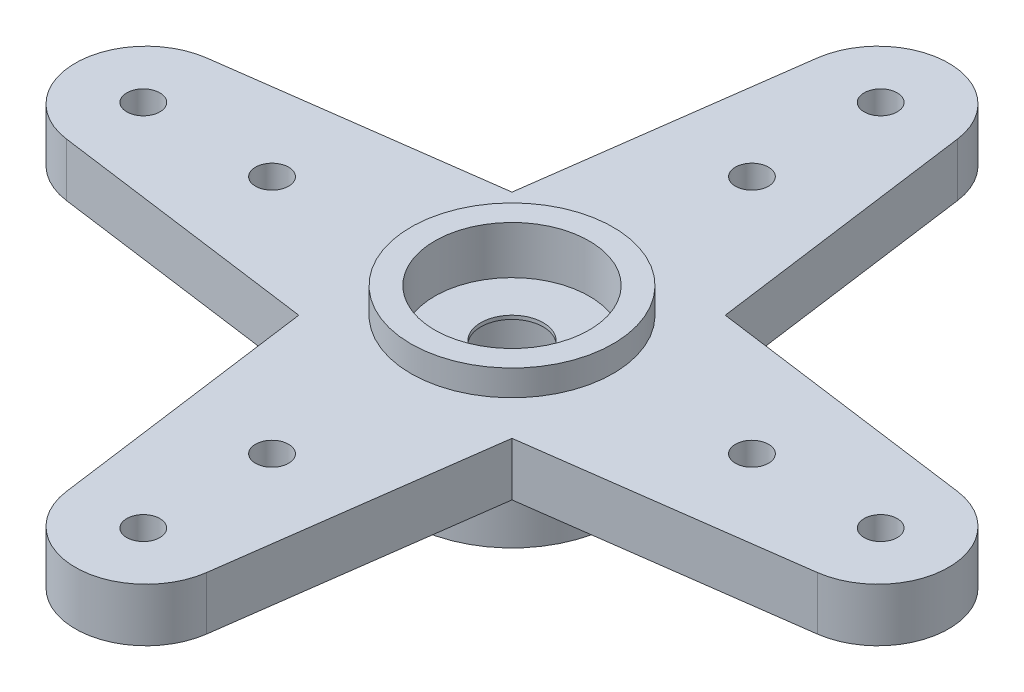
from build123d import *

# Parameters (mm, degrees)
SKETCH1_R           = 2.875
SKETCH1_R_2         = 1.925
BOSS_EXTRUDE1_DEPTH = 2
SKETCH2_R           = 1.925
SKETCH2_R_2         = 2.875
BOSS_EXTRUDE2_DEPTH = 1.45
SKETCH3_R           = 2.75
SKETCH3_R_2         = 2.1
BOSS_EXTRUDE3_DEPTH = 0.7
CUT_EXTRUDE1_START  = -1.3
SKETCH5_R           = 2.1
CUT_EXTRUDE1_DEPTH  = 1.3
SKETCH6_R           = 0.85
CUT_EXTRUDE2_DEPTH  = 18.033900023
SKETCH7_R           = 0.45
CUT_EXTRUDE3_DEPTH  = 18.144496201
SKETCH8_R           = 1.925
CUT_EXTRUDE4_DEPTH  = 0.75


with BuildPart() as part:
    # Sketch1 → Boss-Extrude1 (new body)
    with BuildSketch(Plane(origin=(0, 0, 0), x_dir=(1, 0, 0), z_dir=(0, 1, 0))):
        with Locations(Location((0, 0, 0), (0, 0, 270))):
            Circle(SKETCH1_R)
        with Locations(Location((0, 0, 0), (0, 0, 270))):
            Circle(SKETCH1_R_2, mode=Mode.SUBTRACT)
    extrude(amount=BOSS_EXTRUDE1_DEPTH)

    # Sketch2 → Boss-Extrude2 (add)
    # profile 1 of 7: a face of its own
    with BuildSketch(Plane(origin=(0, 2, 0), x_dir=(1, 0, 0), z_dir=(0, 1, 0))):
        with Locations((-9.95, 0)):
            Circle(SKETCH2_R)
    # profile 2 of 7: a face of its own
    with BuildSketch(Plane(origin=(0, 2, 0), x_dir=(1, 0, 0), z_dir=(0, 1, 0))):
        with BuildLine():
            ThreePointArc((1.925, 9.95), (-0.129680261, 8.029373011), (-1.907527823, 10.208771335))
            Line((-1.907527823, 10.208771335), (-2.899137803, 2.899137803))
            Line((-2.899137803, 2.899137803), (-10.208771335, 1.907527823))
            ThreePointArc((-10.208771335, 1.907527823), (-8.683609424, 1.44978616), (-8.025, 0))
            ThreePointArc((-8.025, 0), (-8.683609424, -1.44978616), (-10.208771335, -1.907527823))
            Line((-10.208771335, -1.907527823), (-2.899137803, -2.899137803))
            Line((-2.899137803, -2.899137803), (-1.907527823, -10.208771335))
            ThreePointArc((-1.907527823, -10.208771335), (-0.129680261, -8.029373011), (1.925, -9.95))
            ThreePointArc((1.925, -9.95), (1.920626989, -10.079680261), (1.907527823, -10.208771335))
            Line((1.907527823, -10.208771335), (2.899137803, -2.899137803))
            Line((2.899137803, -2.899137803), (10.208771335, -1.907527823))
            ThreePointArc((10.208771335, -1.907527823), (8.025, 0), (10.208771335, 1.907527823))
            Line((10.208771335, 1.907527823), (2.899137803, 2.899137803))
            Line((2.899137803, 2.899137803), (1.907527823, 10.208771335))
            ThreePointArc((1.907527823, 10.208771335), (1.920626989, 10.079680261), (1.925, 9.95))
        make_face()
        with Locations(Location((0, 0, 0), (0, 0, 270))):
            Circle(SKETCH2_R_2, mode=Mode.SUBTRACT)
    # profile 3 of 7: a face of its own
    with BuildSketch(Plane(origin=(0, 2, 0), x_dir=(1, 0, 0), z_dir=(0, 1, 0))):
        with Locations(Location((0, 0, 0), (0, 0, 270))):
            Circle(SKETCH2_R_2)
        with Locations(Location((0, 0, 0), (0, 0, 270))):
            Circle(SKETCH2_R, mode=Mode.SUBTRACT)
    # profile 4 of 7: a face of its own
    with BuildSketch(Plane(origin=(0, 2, 0), x_dir=(1, 0, 0), z_dir=(0, 1, 0))):
        with Locations(Location((0, 0, 0), (0, 0, 270))):
            Circle(SKETCH2_R)
    # profile 5 of 7: a face of its own
    with BuildSketch(Plane(origin=(0, 2, 0), x_dir=(1, 0, 0), z_dir=(0, 1, 0))):
        with Locations((0, -9.95)):
            Circle(SKETCH2_R)
    # profile 6 of 7: a face of its own
    with BuildSketch(Plane(origin=(0, 2, 0), x_dir=(1, 0, 0), z_dir=(0, 1, 0))):
        with Locations((9.95, 0)):
            Circle(SKETCH2_R)
    # profile 7 of 7: a face of its own
    with BuildSketch(Plane(origin=(0, 2, 0), x_dir=(1, 0, 0), z_dir=(0, 1, 0))):
        with Locations((0, 9.95)):
            Circle(SKETCH2_R)
    extrude(amount=BOSS_EXTRUDE2_DEPTH)

    # Sketch3 → Boss-Extrude3 (add)
    with BuildSketch(Plane(origin=(0, 3.45, 0), x_dir=(1, 0, 0), z_dir=(0, 1, 0))):
        with Locations(Location((0, 0, 0), (0, 0, 270))):
            Circle(SKETCH3_R)
        with Locations(Location((0, 0, 0), (0, 0, 270))):
            Circle(SKETCH3_R_2, mode=Mode.SUBTRACT)
    extrude(amount=BOSS_EXTRUDE3_DEPTH)

    # Sketch5 → Cut-Extrude1 (cut)
    with BuildSketch(Plane(origin=(0, 4.15, 0), x_dir=(1, 0, 0), z_dir=(0, 1, 0)).offset(CUT_EXTRUDE1_START)):
        with Locations(Location((0, 0, 0), (0, 0, 270))):
            Circle(SKETCH5_R)
    extrude(amount=CUT_EXTRUDE1_DEPTH, mode=Mode.SUBTRACT)

    # Sketch6 → Cut-Extrude2 (cut, through all)
    with BuildSketch(Plane(origin=(0, 2.85, 0), x_dir=(1, 0, 0), z_dir=(0, 1, 0))):
        with Locations(Location((0, 0, 0), (0, 0, 270))):
            Circle(SKETCH6_R)
    extrude(amount=-CUT_EXTRUDE2_DEPTH, mode=Mode.SUBTRACT)

    # Sketch7 → Cut-Extrude3 (cut, through all)
    with BuildSketch(Plane(origin=(0, 3.45, 0), x_dir=(1, 0, 0), z_dir=(0, 1, 0))):
        with Locations(Location((0, 10.025, 0), (0, 0, 270))):
            Circle(SKETCH7_R)
        with Locations(Location((0, 6.525, 0), (0, 0, 270))):
            Circle(SKETCH7_R)
        with Locations(Location((6.525, 0, 0), (0, 0, 270))):
            Circle(SKETCH7_R)
        with Locations(Location((10.025, 0, 0), (0, 0, 270))):
            Circle(SKETCH7_R)
        with Locations(Location((0, -6.525, 0), (0, 0, 270))):
            Circle(SKETCH7_R)
        with Locations(Location((0, -10.025, 0), (0, 0, 270))):
            Circle(SKETCH7_R)
        with Locations(Location((-6.525, 0, 0), (0, 0, 270))):
            Circle(SKETCH7_R)
        with Locations(Location((-10.025, 0, 0), (0, 0, 270))):
            Circle(SKETCH7_R)
    extrude(amount=-CUT_EXTRUDE3_DEPTH, mode=Mode.SUBTRACT)

    # Sketch8 → Cut-Extrude4 (cut)
    with BuildSketch(Plane.XZ.offset(-2)):
        with Locations(Location((0, 0, 0), (0, 0, 270))):
            Circle(SKETCH8_R)
    extrude(amount=-CUT_EXTRUDE4_DEPTH, mode=Mode.SUBTRACT)


solid = part.part
